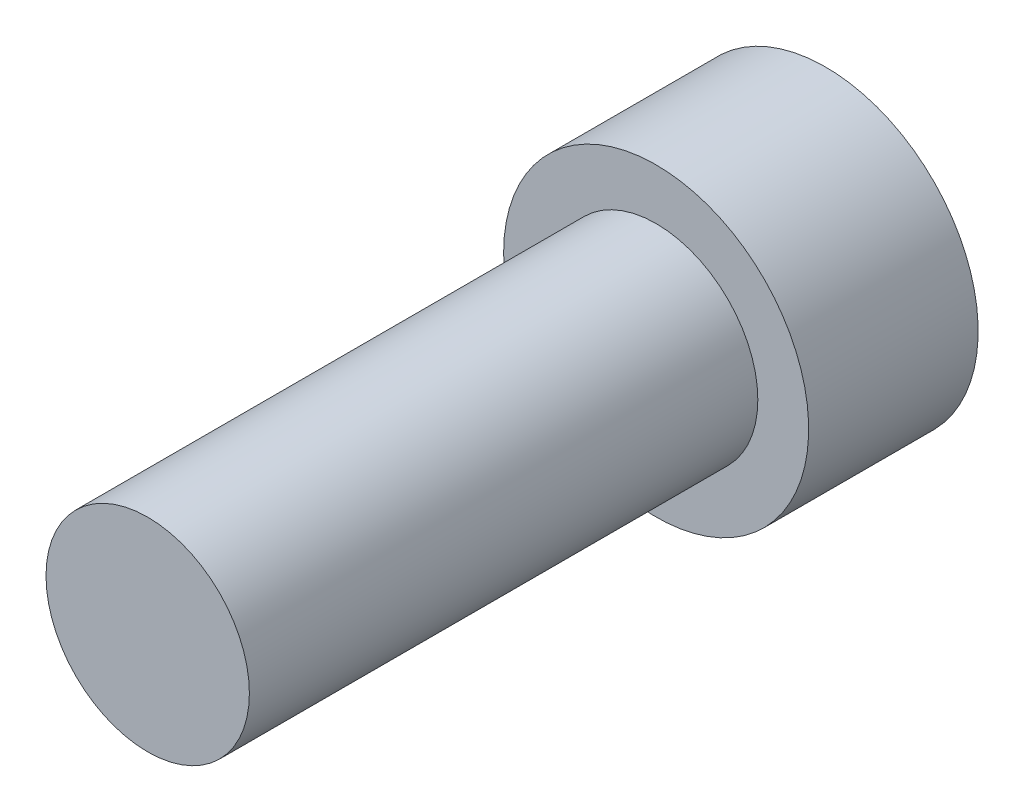
from build123d import *

# Parameters (mm, degrees)
ESQUISSE1_R                  = 3
BASE_EXTRUSION_DEPTH         = 15
ESQUISSE2_R                  = 4.5
BOSS_EXTRU_1_DEPTH           = 5
ENL_V_MAT_EXTRU_3_DEPTH      = 4
R_P_TITION_CIRCULAIRE1_COUNT = 6


with BuildPart() as part:
    # Esquisse1 → Base-Extrusion (new body)
    with BuildSketch(Plane.XY):
        Circle(ESQUISSE1_R)
    extrude(amount=BASE_EXTRUSION_DEPTH)

    # Esquisse2 → Boss.-Extru.1 (add)
    with BuildSketch(Plane(origin=(0, 0, 0), x_dir=(-1, 0, 0), z_dir=(0, 0, -1))):
        Circle(ESQUISSE2_R)
    extrude(amount=BOSS_EXTRU_1_DEPTH)

    # Esquisse3 → Enlèv. mat.-Extru.3 (cut)
    with BuildSketch(Plane(origin=(0, 0, -5), x_dir=(-1, 0, 0), z_dir=(0, 0, -1))):
        Polygon((3, 1.732050808), (0, 0), (3, -1.732050808), align=None)
    enl_v_mat_extru_3 = extrude(amount=-ENL_V_MAT_EXTRU_3_DEPTH, mode=Mode.SUBTRACT)

    # Répétition circulaire1: Enlèv. mat.-Extru.3 ×6 about axis
    r_p_tition_circulaire1_axis = Axis((0, 0, 0), (0, 0, 1))
    for i in range(1, R_P_TITION_CIRCULAIRE1_COUNT):
        add(enl_v_mat_extru_3.rotate(r_p_tition_circulaire1_axis, i * 360 / R_P_TITION_CIRCULAIRE1_COUNT), mode=Mode.SUBTRACT)


solid = part.part
